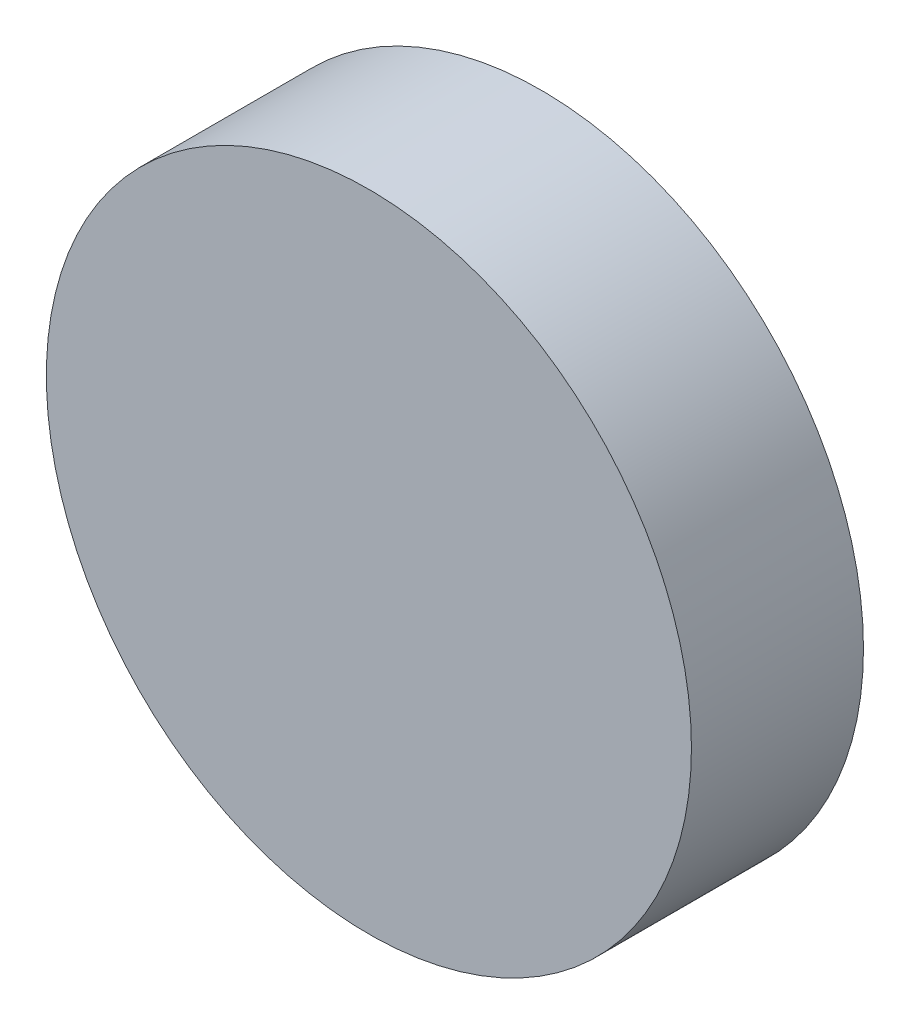
from build123d import *

# Parameters (mm, degrees)
SKETCH2_R           = 15
BOSS_EXTRUDE1_DEPTH = 8
SKETCH3_R           = 3
CUT_EXTRUDE1_DEPTH  = 7.8


with BuildPart() as part:
    # Sketch2 → Boss-Extrude1 (new body)
    with BuildSketch(Plane.XY):
        Circle(SKETCH2_R)
    extrude(amount=BOSS_EXTRUDE1_DEPTH)

    # Sketch3 → Cut-Extrude1 (cut)
    with BuildSketch(Plane(origin=(0, 0, 0), x_dir=(-1, 0, 0), z_dir=(0, 0, -1))):
        Circle(SKETCH3_R)
    extrude(amount=-CUT_EXTRUDE1_DEPTH, mode=Mode.SUBTRACT)


solid = part.part
